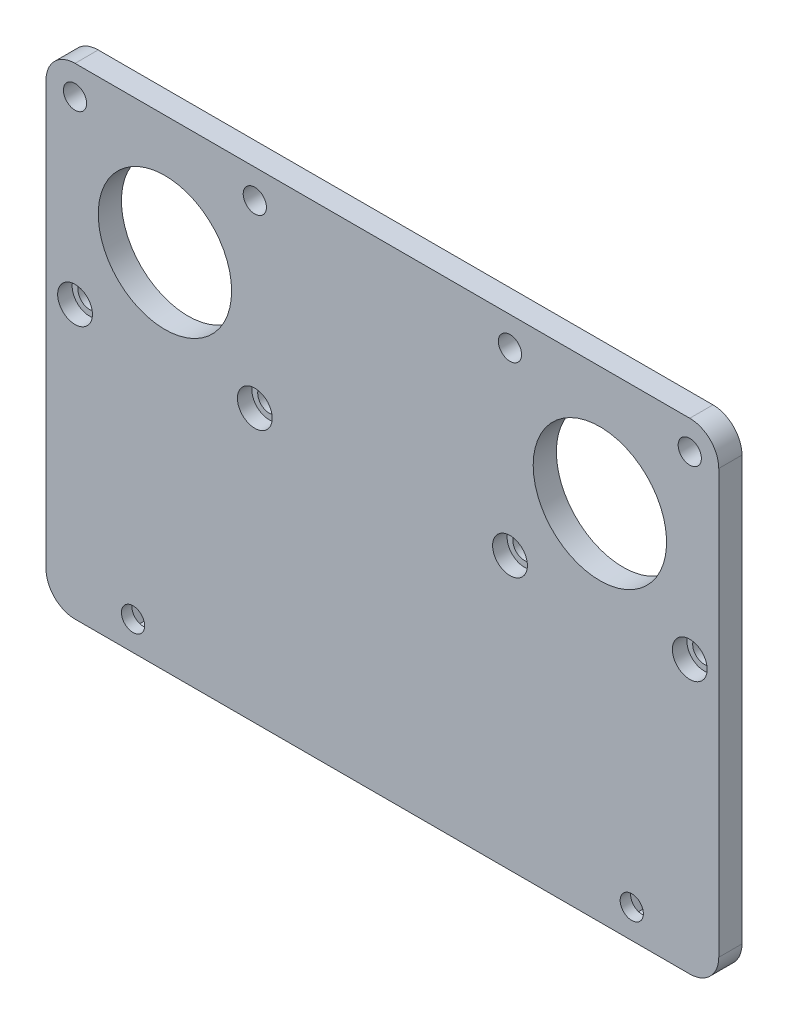
from build123d import *

# Parameters (mm, degrees)
ESQUISSE1_W             = 116
ESQUISSE1_H             = 83
BOSS_EXTRU_1_DEPTH      = 4
CONG_1_R                = 5
ESQUISSE2_R             = 2
ESQUISSE2_R_2           = 11.5
ENL_V_MAT_EXTRU_1_DEPTH = 4
ESQUISSE3_R             = 3
ENL_V_MAT_EXTRU_2_DEPTH = 2.5
ENL_V_START             = -4
ENL_V_MAT_EXTRU_3_DEPTH = 2.2


with BuildPart() as part:
    # Esquisse1 → Boss.-Extru.1 (new body)
    with BuildSketch(Plane.XY):
        with Locations((0.978902954, 8.301687764)):
            Rectangle(ESQUISSE1_W, ESQUISSE1_H)
    extrude(amount=BOSS_EXTRU_1_DEPTH)

    # Congé1
    cong_1_edges = [part.edges().sort_by_distance(p)[0] for p in [
        (-57.021097046, 49.801687764, 2),
        (58.978902954, 49.801687764, 2),
        (58.978902954, -33.198312236, 2),
        (-57.021097046, -33.198312236, 2),
    ]]
    fillet(cong_1_edges, radius=CONG_1_R)

    # Esquisse2 → Enlèv. mat.-Extru.1 (cut)
    with BuildSketch(Plane.XY.offset(4)):
        with Locations((-42.021097046, -28.198312236)):
            Circle(ESQUISSE2_R)
        with Locations((-52.021097046, 44.801687764)):
            Circle(ESQUISSE2_R)
        with Locations((-21.021097046, 44.801687764)):
            Circle(ESQUISSE2_R)
        with Locations((-36.521097046, 29.301687764)):
            Circle(ESQUISSE2_R_2)
        with Locations((-21.021097046, 13.801687764)):
            Circle(ESQUISSE2_R)
        with Locations((-52.021097046, 13.801687764)):
            Circle(ESQUISSE2_R)
        with Locations(Location((43.978902954, -28.198312236, 0), (0, 0, 180))):
            Circle(ESQUISSE2_R)
        with Locations(Location((38.478902954, 29.301687764, 0), (0, 0, 180))):
            Circle(ESQUISSE2_R_2)
        with Locations(Location((22.978902954, 13.801687764, 0), (0, 0, 180))):
            Circle(ESQUISSE2_R)
        with Locations(Location((22.978902954, 44.801687764, 0), (0, 0, 180))):
            Circle(ESQUISSE2_R)
        with Locations(Location((53.978902954, 44.801687764, 0), (0, 0, 180))):
            Circle(ESQUISSE2_R)
        with Locations(Location((53.978902954, 13.801687764, 0), (0, 0, 180))):
            Circle(ESQUISSE2_R)
    extrude(amount=-ENL_V_MAT_EXTRU_1_DEPTH, mode=Mode.SUBTRACT)

    # Esquisse3 → Enlèv. mat.-Extru.2 (cut)
    with BuildSketch(Plane.XY.offset(4)):
        with Locations((-52.021097046, 13.801687764)):
            Circle(ESQUISSE3_R)
        with Locations((-21.021097046, 13.801687764)):
            Circle(ESQUISSE3_R)
        with Locations((22.978902954, 13.801687764)):
            Circle(ESQUISSE3_R)
        with Locations((53.978902954, 13.801687764)):
            Circle(ESQUISSE3_R)
    extrude(amount=-ENL_V_MAT_EXTRU_2_DEPTH, mode=Mode.SUBTRACT)

    # Esquisse4 → Enlèv. mat.-Extru.3 (cut)
    with BuildSketch(Plane.XY.offset(4).offset(ENL_V_START)):
        Polygon((-43.753147854, -25.198312236), (-45.485198662, -28.198312236), (-43.753147854, -31.198312236), (-40.289046239, -31.198312236), (-38.556995431, -28.198312236), (-40.289046239, -25.198312236), align=None)
        Polygon((42.246852146, -25.198312236), (40.514801338, -28.198312236), (42.246852146, -31.198312236), (45.710953761, -31.198312236), (47.443004569, -28.198312236), (45.710953761, -25.198312236), align=None)
    extrude(amount=ENL_V_MAT_EXTRU_3_DEPTH, mode=Mode.SUBTRACT)


solid = part.part
